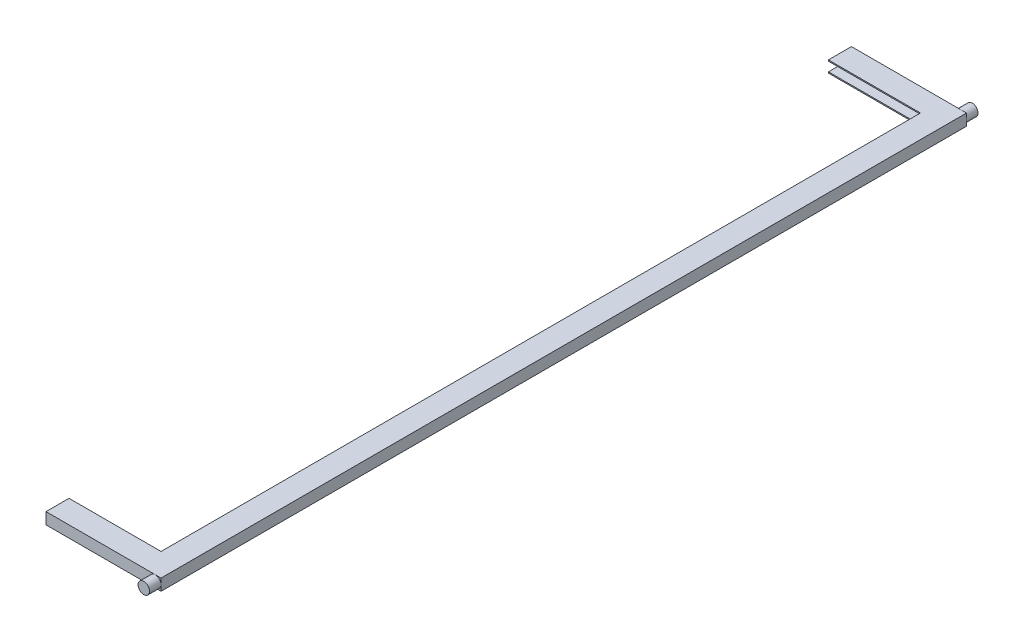
from build123d import *

# Parameters (mm, degrees)
CROQUIS1_W              = 100
CROQUIS1_H              = 700
SALIENTE_EXTRUIR1_DEPTH = 10
CROQUIS2_R              = 5
SALIENTE_EXTRUIR2_DEPTH = 10
SALIENTE_EXTRUIR3_START = 10
CROQUIS3_R              = 5
SALIENTE_EXTRUIR3_DEPTH = 10
CROQUIS4_W              = 698
CROQUIS4_H              = 8
CORTAR_EXTRUIR1_DEPTH   = 90
CROQUIS5_W              = 80
CROQUIS5_H              = 660
CORTAR_EXTRUIR2_DEPTH   = 10


with BuildPart() as part:
    # Croquis1 → Saliente-Extruir1 (new body)
    with BuildSketch(Plane(origin=(0, 0, 0), x_dir=(1, 0, 0), z_dir=(0, 1, 0))):
        Rectangle(CROQUIS1_W, CROQUIS1_H)
    extrude(amount=SALIENTE_EXTRUIR1_DEPTH)

    # Croquis2 → Saliente-Extruir2 (add)
    with BuildSketch(Plane.XY.offset(350)):
        with Locations((45, 5)):
            Circle(CROQUIS2_R)
    extrude(amount=SALIENTE_EXTRUIR2_DEPTH)

    # Croquis3 → Saliente-Extruir3 (add)
    with BuildSketch(Plane(origin=(0, 0, -350), x_dir=(-1, 0, 0), z_dir=(0, 0, -1)).offset(SALIENTE_EXTRUIR3_START)):
        with Locations(Location((-45, 5, 0), (0, 0, 180))):
            Circle(CROQUIS3_R)
    extrude(amount=-SALIENTE_EXTRUIR3_DEPTH)

    # Croquis4 → Cortar-Extruir1 (cut)
    with BuildSketch(Plane.ZY.offset(50)):
        with Locations((0, 5)):
            Rectangle(CROQUIS4_W, CROQUIS4_H)
    extrude(amount=-CORTAR_EXTRUIR1_DEPTH, mode=Mode.SUBTRACT)

    # Croquis5 → Cortar-Extruir2 (cut)
    with BuildSketch(Plane(origin=(0, 10, 0), x_dir=(1, 0, 0), z_dir=(0, 1, 0))):
        with Locations((-10, 0)):
            Rectangle(CROQUIS5_W, CROQUIS5_H)
    extrude(amount=-CORTAR_EXTRUIR2_DEPTH, mode=Mode.SUBTRACT)


solid = part.part
